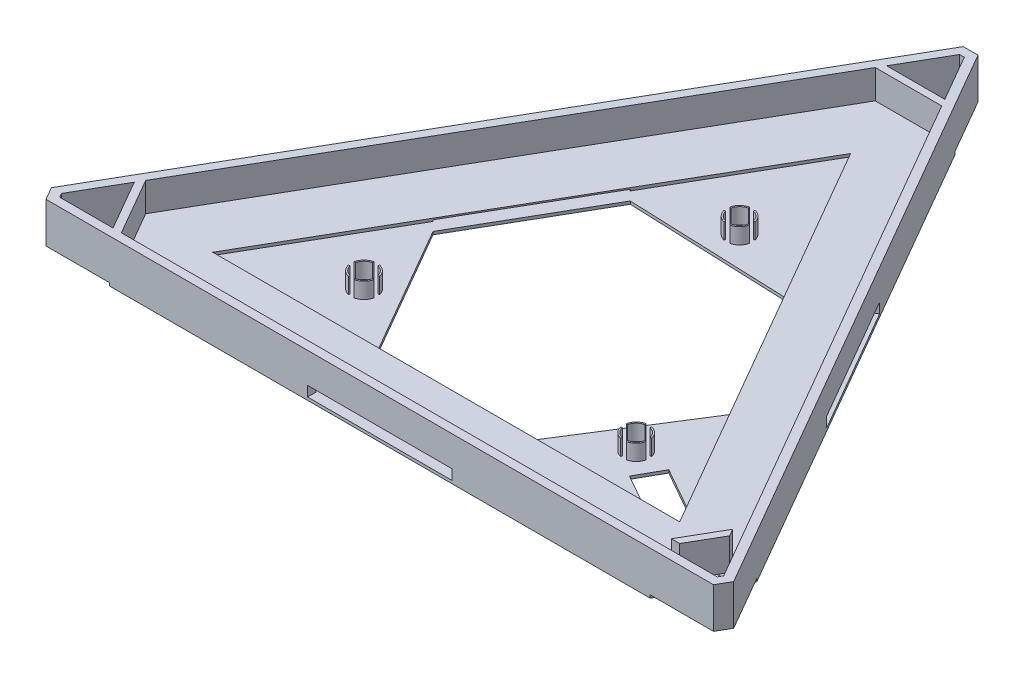
from build123d import *

# Parameters (mm, degrees)
BOSS_EXTRUDE1_DEPTH      = 1
BOSS_EXTRUDE2_DEPTH      = 11
BOSS_EXTRUDE3_DEPTH      = 5
BOSS_EXTRUDE3_DEPTH_BACK = 3
SKETCH3_W                = 50
SKETCH3_H                = 7
CUT_EXTRUDE3_DEPTH       = 25
SKETCH5_W                = 50
SKETCH5_H                = 7
CUT_EXTRUDE4_DEPTH       = 25
SKETCH6_W                = 50
SKETCH6_H                = 7
CUT_EXTRUDE5_DEPTH       = 25
SKETCH8_R                = 1.5
BOSS_EXTRUDE5_DEPTH      = 1
BOSS_EXTRUDE10_DEPTH     = 5.5


with BuildPart() as part:
    # Sketch1 → Boss-Extrude1 (new body)
    with BuildSketch(Plane(origin=(0, 0, 0), x_dir=(1, 0, 0), z_dir=(0, 1, 0))):
        Polygon((243.304219773, -116.484791866), (254.809280576, -136.408896139), (442.602090749, -136.409305398), (444.621046679, -132.925433223), (441.749040748, -132.925433223), (449.516726723, -119.471406457), (450.964695297, -121.978953122), (452.699916621, -118.984688017), (358.778179035, 43.666038066), (335.767496284, 43.666038066), align=None)
        Polygon((428.113670919, -116.417164681), (266.439108268, -116.428009241), (347.273609729, 23.609230825), align=None, mode=Mode.SUBTRACT)
    extrude(amount=BOSS_EXTRUDE1_DEPTH)

    # Sketch1<9> → Boss-Extrude2 (add)
    # profile 1 of 2: a face of its own
    with BuildSketch(Plane(origin=(0, 0, 0), x_dir=(1, 0, 0), z_dir=(0, 1, 0))):
        Polygon((229.159432547, -134.984249184), (231.716666588, -139.412373829), (462.829865412, -139.412373829), (465.38624875, -134.984588004), (349.829542096, 65.165499075), (344.716133219, 65.165499075), align=None)
        Polygon((251.922647988, -136.4093054), (233.446303399, -136.408896139), (232.623553959, -134.984217358), (241.860901688, -118.984688019), align=None, mode=Mode.SUBTRACT)
        Polygon((442.602090749, -136.409305398), (254.809280576, -136.408896139), (243.304219773, -116.484791866), (335.767496284, 43.666038066), (358.778179035, 43.666038066), (461.938967957, -134.984588004), (461.116393748, -136.409305398), align=None, mode=Mode.SUBTRACT)
        Polygon((348.096628302, 62.164013367), (357.334800991, 46.166038067), (337.210874326, 46.166038067), (346.44844193, 62.165948237), align=None, mode=Mode.SUBTRACT)
    # profile 2 of 2: a face of its own
    with BuildSketch(Plane(origin=(0, 0, 0), x_dir=(1, 0, 0), z_dir=(0, 1, 0))):
        Polygon((441.749040748, -132.925433223), (444.621046679, -132.925433223), (450.964695297, -121.978953122), (449.516726723, -119.471406457), align=None)
    extrude(amount=BOSS_EXTRUDE2_DEPTH)

    # Sketch1<10> → Boss-Extrude3 (add, two sides: drawn at the far end of the back side and taken through both)
    with BuildSketch(Plane(origin=(0, 0, 0), x_dir=(1, 0, 0), z_dir=(0, 1, 0)).offset(-BOSS_EXTRUDE3_DEPTH_BACK)):
        Polygon((229.159432547, -134.984249184), (231.716666588, -139.412373829), (462.829865412, -139.412373829), (465.38624875, -134.984588004), (349.829542096, 65.165499075), (344.716133219, 65.165499075), align=None)
        Polygon((251.922647988, -136.4093054), (233.446303399, -136.408896139), (232.623553959, -134.984217358), (241.860901688, -118.984688019), align=None, mode=Mode.SUBTRACT)
        Polygon((442.602090749, -136.409305398), (254.809280576, -136.408896139), (243.304219773, -116.484791866), (335.767496284, 43.666038066), (358.778179035, 43.666038066), (452.699916621, -118.984688017), (461.938967957, -134.984588004), (461.116393748, -136.409305398), align=None, mode=Mode.SUBTRACT)
        Polygon((348.096628302, 62.164013367), (357.334800991, 46.166038067), (337.210874326, 46.166038067), (346.44844193, 62.165948237), align=None, mode=Mode.SUBTRACT)
    extrude(amount=BOSS_EXTRUDE3_DEPTH + BOSS_EXTRUDE3_DEPTH_BACK)

    # Sketch3 → Cut-Extrude3 (cut)
    with BuildSketch(Plane(origin=(290.589645397, 0, -167.772009994), x_dir=(-0.49999999999998745, 0, -0.8660254037844459), z_dir=(0.8660254037844459, 0, -0.49999999999998745))):
        with Locations((-236.592990632, -3)):
            Rectangle(SKETCH3_W, SKETCH3_H)
    extrude(amount=-CUT_EXTRUDE3_DEPTH, mode=Mode.SUBTRACT)

    # Sketch5 → Cut-Extrude4 (cut)
    with BuildSketch(Plane.XY.offset(139.412373829)):
        with Locations((347.273266, -3)):
            Rectangle(SKETCH5_W, SKETCH5_H)
    extrude(amount=-CUT_EXTRUDE4_DEPTH, mode=Mode.SUBTRACT)

    # Sketch6 → Cut-Extrude5 (cut)
    with BuildSketch(Plane(origin=(230.319375797, 0, 132.975171838), x_dir=(-0.5000006154012504, 0, 0.8660250484820695), z_dir=(-0.8660250484820695, 0, -0.5000006154012504))):
        with Locations((-113.2366748, -3)):
            Rectangle(SKETCH6_W, SKETCH6_H)
    extrude(amount=-CUT_EXTRUDE5_DEPTH, mode=Mode.SUBTRACT)

    # Sketch8 → Boss-Extrude5 (add)
    with BuildSketch(Plane.XZ.offset(3)):
        Polygon((246.891774838, 127.696996709), (240.128710529, 115.984933576), (333.74677129, -46.166038067), (360.798886024, -46.166038067), (454.427535986, 116.00354071), (450.14703547, 123.280701064), (406.618322212, 98.678849058), (401.697951811, 107.384591709), (445.226665069, 131.986443715), (440.912417704, 139.412373829), (253.656752788, 139.412373829), align=None)
        with Locations((395.323540807, 98.692824234)):
            Circle(SKETCH8_R, mode=Mode.SUBTRACT)
        with Locations((348.301285092, 15.863526629)):
            Circle(SKETCH8_R, mode=Mode.SUBTRACT)
        with Locations((299.654911442, 97.241681781)):
            Circle(SKETCH8_R, mode=Mode.SUBTRACT)
        Polygon((322.273266, 116.424264082), (294.358218631, 68.061097964), (319.354499366, 24.757680453), (376.473657317, 26.969372805), (401.47267951, 70.271207531), (372.273266, 116.420910258), align=None, mode=Mode.SUBTRACT)
    extrude(amount=BOSS_EXTRUDE5_DEPTH)

    # Sketch12 → Boss-Extrude10 (add)
    with BuildSketch(Plane(origin=(0, -3, 0), x_dir=(1, 0, 0), z_dir=(0, 1, 0))):
        with BuildLine():
            ThreePointArc((352.69017398, -14.869718639), (351.483265607, -12.681546113), (349.295093082, -11.47463774))
            Line((349.295093082, -11.47463774), (349.184669972, -11.962292061))
            ThreePointArc((349.184669972, -11.962292061), (351.129712216, -13.035099504), (352.202519659, -14.980141749))
            Line((352.202519659, -14.980141749), (352.69017398, -14.869718639))
        make_face()
        with BuildLine():
            Line((347.417900212, -11.962292061), (347.307477102, -11.47463774))
            ThreePointArc((347.307477102, -11.47463774), (345.119304576, -12.681546113), (343.912396203, -14.869718639))
            Line((343.912396203, -14.869718639), (344.400050524, -14.980141749))
            ThreePointArc((344.400050524, -14.980141749), (345.472857967, -13.035099504), (347.417900212, -11.962292061))
        make_face()
        with BuildLine():
            ThreePointArc((349.295093082, -20.252415518), (351.483265607, -19.045507144), (352.69017398, -16.857334619))
            Line((352.69017398, -16.857334619), (352.202519659, -16.746911509))
            ThreePointArc((352.202519659, -16.746911509), (351.129712216, -18.691953754), (349.184669972, -19.764761197))
            Line((349.184669972, -19.764761197), (349.295093082, -20.252415518))
        make_face()
        with BuildLine():
            Line((344.400050524, -16.746911509), (343.912396203, -16.857334619))
            ThreePointArc((343.912396203, -16.857334619), (345.119304576, -19.045507144), (347.307477102, -20.252415518))
            Line((347.307477102, -20.252415518), (347.417900212, -19.764761197))
            ThreePointArc((347.417900212, -19.764761197), (345.472857967, -18.691953754), (344.400050524, -16.746911509))
        make_face()
        with BuildLine():
            Line((394.440155927, -94.791589666), (394.329732817, -94.303935345))
            ThreePointArc((394.329732817, -94.303935345), (392.141560292, -95.510843719), (390.934651919, -97.699016244))
            Line((390.934651919, -97.699016244), (391.4247896, -97.798542945))
            ThreePointArc((391.4247896, -97.798542945), (392.499067689, -95.860448622), (394.440155927, -94.791589666))
        make_face()
        with BuildLine():
            ThreePointArc((399.712429696, -97.699016244), (398.505521323, -95.510843719), (396.317348797, -94.303935345))
            Line((396.317348797, -94.303935345), (396.206925687, -94.791589666))
            ThreePointArc((396.206925687, -94.791589666), (398.151967932, -95.864397109), (399.224775375, -97.809439354))
            Line((399.224775375, -97.809439354), (399.712429696, -97.699016244))
        make_face()
        with BuildLine():
            Line((391.422306239, -99.576209114), (390.934651919, -99.686632224))
            ThreePointArc((390.934651919, -99.686632224), (392.141560292, -101.874804749), (394.329732817, -103.081713123))
            Line((394.329732817, -103.081713123), (394.440155927, -102.594058802))
            ThreePointArc((394.440155927, -102.594058802), (392.495113683, -101.521251359), (391.422306239, -99.576209114))
        make_face()
        with BuildLine():
            ThreePointArc((396.317348797, -103.081713123), (398.505521323, -101.874804749), (399.712429696, -99.686632224))
            Line((399.712429696, -99.686632224), (399.224775375, -99.576209114))
            ThreePointArc((399.224775375, -99.576209114), (398.151967932, -101.521251359), (396.206925687, -102.594058802))
            Line((396.206925687, -102.594058802), (396.317348797, -103.081713123))
        make_face()
        with BuildLine():
            ThreePointArc((298.661103452, -92.852792892), (296.472930927, -94.059701266), (295.266022553, -96.247873791))
            Line((295.266022553, -96.247873791), (295.753676874, -96.358296901))
            ThreePointArc((295.753676874, -96.358296901), (296.826484317, -94.413254657), (298.771526562, -93.340447213))
            Line((298.771526562, -93.340447213), (298.661103452, -92.852792892))
        make_face()
        with BuildLine():
            Line((295.753676874, -98.125066661), (295.266022553, -98.235489771))
            ThreePointArc((295.266022553, -98.235489771), (296.472930927, -100.423662297), (298.661103452, -101.63057067))
            Line((298.661103452, -101.63057067), (298.771526562, -101.142916349))
            ThreePointArc((298.771526562, -101.142916349), (296.826484317, -100.070108906), (295.753676874, -98.125066661))
        make_face()
        with BuildLine():
            ThreePointArc((304.043800331, -96.247873791), (302.836891957, -94.059701266), (300.648719432, -92.852792892))
            Line((300.648719432, -92.852792892), (300.538296322, -93.340447213))
            ThreePointArc((300.538296322, -93.340447213), (302.483338567, -94.413254657), (303.55614601, -96.358296901))
            Line((303.55614601, -96.358296901), (304.043800331, -96.247873791))
        make_face()
        with BuildLine():
            Line((300.538296322, -101.142916349), (300.648719432, -101.63057067))
            ThreePointArc((300.648719432, -101.63057067), (302.836891957, -100.423662297), (304.043800331, -98.235489771))
            Line((304.043800331, -98.235489771), (303.55614601, -98.125066661))
            ThreePointArc((303.55614601, -98.125066661), (302.483338567, -100.070108906), (300.538296322, -101.142916349))
        make_face()
    extrude(amount=BOSS_EXTRUDE10_DEPTH)


solid = part.part
